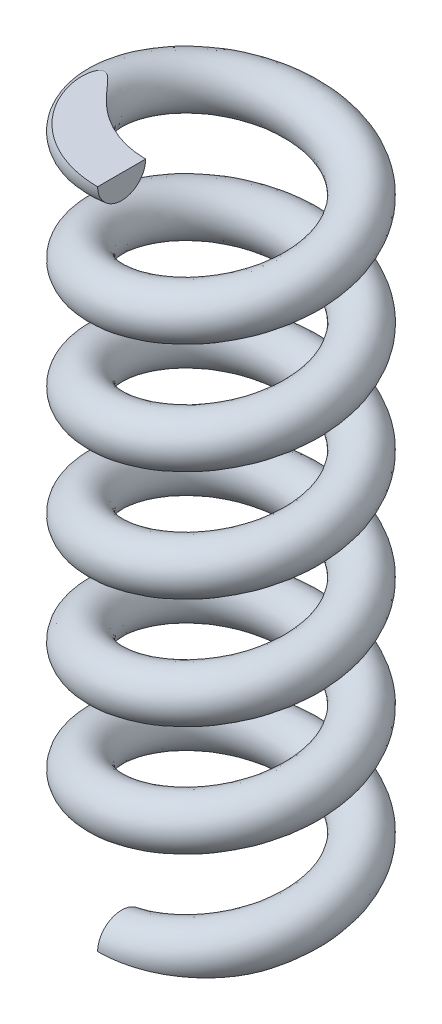
from build123d import *

# Parameters (mm, degrees)
SWEEP1_PITCH       = 16.666666667
SWEEP1_HEIGHT      = 100
SWEEP1_RADIUS      = 15
SWEEP1_START_ANGLE = 180
SKETCH13_R         = 3.625
SKETCH14_R         = 20
CUT_EXTRUDE1_DEPTH = 10
SKETCH16_R         = 20
CUT_EXTRUDE2_DEPTH = 10


with BuildPart() as part:
    # Sweep1: sweep along a helix
    with BuildLine() as sweep1_path:
        add(Helix(SWEEP1_PITCH, SWEEP1_HEIGHT, SWEEP1_RADIUS, center=(0, 0, 0), direction=(0, -1, 0), mode=Mode.PRIVATE).rotate(Axis((0, 0, 0), (0, -1, 0)), SWEEP1_START_ANGLE))
    # Sketch13 → Sweep1 (sweep)
    with BuildSketch(Plane(origin=(0, 0, 0), x_dir=(0, 0, -1), z_dir=(1, 0, 0))):
        with Locations((-15, -100)):
            Circle(SKETCH13_R)
    sweep(path=sweep1_path.line, is_frenet=True)

    # Sketch14 → Cut-Extrude1 (cut)
    with BuildSketch(Plane(origin=(0, 0, 0), x_dir=(1, 0, 0), z_dir=(0, 1, 0))):
        Circle(SKETCH14_R)
    extrude(amount=CUT_EXTRUDE1_DEPTH, mode=Mode.SUBTRACT)

    # Sketch16 → Cut-Extrude2 (cut)
    with BuildSketch(Plane(origin=(0, -100, 0), x_dir=(1, 0, 0), z_dir=(0, 1, 0))):
        Circle(SKETCH16_R)
    extrude(amount=-CUT_EXTRUDE2_DEPTH, mode=Mode.SUBTRACT)


solid = part.part
